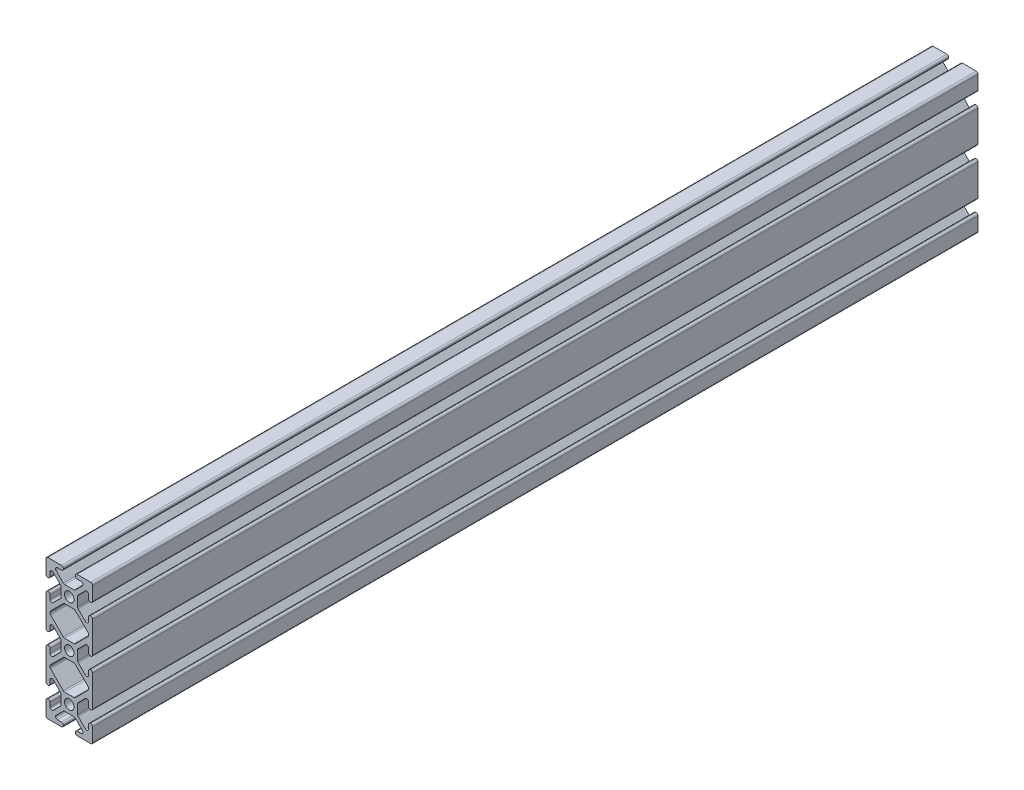
from build123d import *

# Parameters (mm, degrees)
SKETCH1_R            = 2.6035
MAIN_EXTRUSION_DEPTH = 241.3


with BuildPart() as part:
    # Sketch1 → Main Extrusion (new, symmetric)
    with BuildSketch(Plane.XY):
        with BuildLine():
            Line((-12.7, 37.084), (-12.7, 29.6672))
            ThreePointArc((-12.7, 29.6672), (-12.40242049, 28.94877951), (-11.684, 28.6512))
            Line((-11.684, 28.6512), (-11.5062, 28.6512))
            ThreePointArc((-11.5062, 28.6512), (-10.78777951, 28.94877951), (-10.4902, 29.6672))
            Line((-10.4902, 29.6672), (-10.4902, 31.874794456))
            ThreePointArc((-10.4902, 31.874794456), (-9.863006367, 32.813456061), (-8.75577951, 32.593214945))
            Line((-8.75577951, 32.593214945), (-4.81877951, 28.656214945))
            ThreePointArc((-4.81877951, 28.656214945), (-4.598538395, 28.326600823), (-4.5212, 27.937794456))
            Line((-4.5212, 27.937794456), (-4.5212, 22.862205544))
            ThreePointArc((-4.5212, 22.862205544), (-4.598538395, 22.473399177), (-4.81877951, 22.143785055))
            Line((-4.81877951, 22.143785055), (-8.75577951, 18.206785055))
            ThreePointArc((-8.75577951, 18.206785055), (-9.863006367, 17.986543939), (-10.4902, 18.925205544))
            Line((-10.4902, 18.925205544), (-10.4902, 21.1328))
            ThreePointArc((-10.4902, 21.1328), (-10.78777951, 21.85122049), (-11.5062, 22.1488))
            Line((-11.5062, 22.1488), (-11.684, 22.1488))
            ThreePointArc((-11.684, 22.1488), (-12.40242049, 21.85122049), (-12.7, 21.1328))
            Line((-12.7, 21.1328), (-12.7, 4.2672))
            ThreePointArc((-12.7, 4.2672), (-12.40242049, 3.54877951), (-11.684, 3.2512))
            Line((-11.684, 3.2512), (-11.5062, 3.2512))
            ThreePointArc((-11.5062, 3.2512), (-10.78777951, 3.54877951), (-10.4902, 4.2672))
            Line((-10.4902, 4.2672), (-10.4902, 6.474794456))
            ThreePointArc((-10.4902, 6.474794456), (-9.863006367, 7.413456061), (-8.75577951, 7.193214945))
            Line((-8.75577951, 7.193214945), (-4.81877951, 3.256214945))
            ThreePointArc((-4.81877951, 3.256214945), (-4.598538395, 2.926600823), (-4.5212, 2.537794456))
            Line((-4.5212, 2.537794456), (-4.5212, -2.537794456))
            ThreePointArc((-4.5212, -2.537794456), (-4.598538395, -2.926600823), (-4.81877951, -3.256214945))
            Line((-4.81877951, -3.256214945), (-8.75577951, -7.193214945))
            ThreePointArc((-8.75577951, -7.193214945), (-9.863006367, -7.413456061), (-10.4902, -6.474794456))
            Line((-10.4902, -6.474794456), (-10.4902, -4.2672))
            ThreePointArc((-10.4902, -4.2672), (-10.78777951, -3.54877951), (-11.5062, -3.2512))
            Line((-11.5062, -3.2512), (-11.684, -3.2512))
            ThreePointArc((-11.684, -3.2512), (-12.40242049, -3.54877951), (-12.7, -4.2672))
            Line((-12.7, -4.2672), (-12.7, -21.1328))
            ThreePointArc((-12.7, -21.1328), (-12.40242049, -21.85122049), (-11.684, -22.1488))
            Line((-11.684, -22.1488), (-11.5062, -22.1488))
            ThreePointArc((-11.5062, -22.1488), (-10.78777951, -21.85122049), (-10.4902, -21.1328))
            Line((-10.4902, -21.1328), (-10.4902, -18.925205544))
            ThreePointArc((-10.4902, -18.925205544), (-9.863006367, -17.986543939), (-8.75577951, -18.206785055))
            Line((-8.75577951, -18.206785055), (-4.81877951, -22.143785055))
            ThreePointArc((-4.81877951, -22.143785055), (-4.598538395, -22.473399177), (-4.5212, -22.862205544))
            Line((-4.5212, -22.862205544), (-4.5212, -27.937794456))
            ThreePointArc((-4.5212, -27.937794456), (-4.598538395, -28.326600823), (-4.81877951, -28.656214945))
            Line((-4.81877951, -28.656214945), (-8.75577951, -32.593214945))
            ThreePointArc((-8.75577951, -32.593214945), (-9.863006367, -32.813456061), (-10.4902, -31.874794456))
            Line((-10.4902, -31.874794456), (-10.4902, -29.6672))
            ThreePointArc((-10.4902, -29.6672), (-10.78777951, -28.94877951), (-11.5062, -28.6512))
            Line((-11.5062, -28.6512), (-11.684, -28.6512))
            ThreePointArc((-11.684, -28.6512), (-12.40242049, -28.94877951), (-12.7, -29.6672))
            Line((-12.7, -29.6672), (-12.7, -37.084))
            ThreePointArc((-12.7, -37.084), (-12.40242049, -37.80242049), (-11.684, -38.1))
            Line((-11.684, -38.1), (-4.2672, -38.1))
            ThreePointArc((-4.2672, -38.1), (-3.54877951, -37.80242049), (-3.2512, -37.084))
            Line((-3.2512, -37.084), (-3.2512, -36.9062))
            ThreePointArc((-3.2512, -36.9062), (-3.54877951, -36.18777951), (-4.2672, -35.8902))
            Line((-4.2672, -35.8902), (-6.474794456, -35.8902))
            ThreePointArc((-6.474794456, -35.8902), (-7.413456061, -35.263006367), (-7.193214945, -34.15577951))
            Line((-7.193214945, -34.15577951), (-3.256214945, -30.21877951))
            ThreePointArc((-3.256214945, -30.21877951), (-2.926600823, -29.998538395), (-2.537794456, -29.9212))
            Line((-2.537794456, -29.9212), (2.537794456, -29.9212))
            ThreePointArc((2.537794456, -29.9212), (2.926600823, -29.998538395), (3.256214945, -30.21877951))
            Line((3.256214945, -30.21877951), (7.193214945, -34.15577951))
            ThreePointArc((7.193214945, -34.15577951), (7.413456061, -35.263006367), (6.474794456, -35.8902))
            Line((6.474794456, -35.8902), (4.2672, -35.8902))
            ThreePointArc((4.2672, -35.8902), (3.54877951, -36.18777951), (3.2512, -36.9062))
            Line((3.2512, -36.9062), (3.2512, -37.084))
            ThreePointArc((3.2512, -37.084), (3.54877951, -37.80242049), (4.2672, -38.1))
            Line((4.2672, -38.1), (11.684, -38.1))
            ThreePointArc((11.684, -38.1), (12.40242049, -37.80242049), (12.7, -37.084))
            Line((12.7, -37.084), (12.7, -29.6672))
            ThreePointArc((12.7, -29.6672), (12.40242049, -28.94877951), (11.684, -28.6512))
            Line((11.684, -28.6512), (11.5062, -28.6512))
            ThreePointArc((11.5062, -28.6512), (10.78777951, -28.94877951), (10.4902, -29.6672))
            Line((10.4902, -29.6672), (10.4902, -31.874794456))
            ThreePointArc((10.4902, -31.874794456), (9.863006367, -32.813456061), (8.75577951, -32.593214945))
            Line((8.75577951, -32.593214945), (4.81877951, -28.656214945))
            ThreePointArc((4.81877951, -28.656214945), (4.598538395, -28.326600823), (4.5212, -27.937794456))
            Line((4.5212, -27.937794456), (4.5212, -22.862205544))
            ThreePointArc((4.5212, -22.862205544), (4.598538395, -22.473399177), (4.81877951, -22.143785055))
            Line((4.81877951, -22.143785055), (8.75577951, -18.206785055))
            ThreePointArc((8.75577951, -18.206785055), (9.863006367, -17.986543939), (10.4902, -18.925205544))
            Line((10.4902, -18.925205544), (10.4902, -21.1328))
            ThreePointArc((10.4902, -21.1328), (10.78777951, -21.85122049), (11.5062, -22.1488))
            Line((11.5062, -22.1488), (11.684, -22.1488))
            ThreePointArc((11.684, -22.1488), (12.40242049, -21.85122049), (12.7, -21.1328))
            Line((12.7, -21.1328), (12.7, -4.2672))
            ThreePointArc((12.7, -4.2672), (12.40242049, -3.54877951), (11.684, -3.2512))
            Line((11.684, -3.2512), (11.5062, -3.2512))
            ThreePointArc((11.5062, -3.2512), (10.78777951, -3.54877951), (10.4902, -4.2672))
            Line((10.4902, -4.2672), (10.4902, -6.474794456))
            ThreePointArc((10.4902, -6.474794456), (9.863006367, -7.413456061), (8.75577951, -7.193214945))
            Line((8.75577951, -7.193214945), (4.81877951, -3.256214945))
            ThreePointArc((4.81877951, -3.256214945), (4.598538395, -2.926600823), (4.5212, -2.537794456))
            Line((4.5212, -2.537794456), (4.5212, 2.537794456))
            ThreePointArc((4.5212, 2.537794456), (4.598538395, 2.926600823), (4.81877951, 3.256214945))
            Line((4.81877951, 3.256214945), (8.75577951, 7.193214945))
            ThreePointArc((8.75577951, 7.193214945), (9.863006367, 7.413456061), (10.4902, 6.474794456))
            Line((10.4902, 6.474794456), (10.4902, 4.2672))
            ThreePointArc((10.4902, 4.2672), (10.78777951, 3.54877951), (11.5062, 3.2512))
            Line((11.5062, 3.2512), (11.684, 3.2512))
            ThreePointArc((11.684, 3.2512), (12.40242049, 3.54877951), (12.7, 4.2672))
            Line((12.7, 4.2672), (12.7, 21.1328))
            ThreePointArc((12.7, 21.1328), (12.40242049, 21.85122049), (11.684, 22.1488))
            Line((11.684, 22.1488), (11.5062, 22.1488))
            ThreePointArc((11.5062, 22.1488), (10.78777951, 21.85122049), (10.4902, 21.1328))
            Line((10.4902, 21.1328), (10.4902, 18.925205544))
            ThreePointArc((10.4902, 18.925205544), (9.863006367, 17.986543939), (8.75577951, 18.206785055))
            Line((8.75577951, 18.206785055), (4.81877951, 22.143785055))
            ThreePointArc((4.81877951, 22.143785055), (4.598538395, 22.473399177), (4.5212, 22.862205544))
            Line((4.5212, 22.862205544), (4.5212, 27.937794456))
            ThreePointArc((4.5212, 27.937794456), (4.598538395, 28.326600823), (4.81877951, 28.656214945))
            Line((4.81877951, 28.656214945), (8.75577951, 32.593214945))
            ThreePointArc((8.75577951, 32.593214945), (9.863006367, 32.813456061), (10.4902, 31.874794456))
            Line((10.4902, 31.874794456), (10.4902, 29.6672))
            ThreePointArc((10.4902, 29.6672), (10.78777951, 28.94877951), (11.5062, 28.6512))
            Line((11.5062, 28.6512), (11.684, 28.6512))
            ThreePointArc((11.684, 28.6512), (12.40242049, 28.94877951), (12.7, 29.6672))
            Line((12.7, 29.6672), (12.7, 37.084))
            ThreePointArc((12.7, 37.084), (12.40242049, 37.80242049), (11.684, 38.1))
            Line((11.684, 38.1), (4.2672, 38.1))
            ThreePointArc((4.2672, 38.1), (3.54877951, 37.80242049), (3.2512, 37.084))
            Line((3.2512, 37.084), (3.2512, 36.9062))
            ThreePointArc((3.2512, 36.9062), (3.54877951, 36.18777951), (4.2672, 35.8902))
            Line((4.2672, 35.8902), (6.474794456, 35.8902))
            ThreePointArc((6.474794456, 35.8902), (7.413456061, 35.263006367), (7.193214945, 34.15577951))
            Line((7.193214945, 34.15577951), (3.256214945, 30.21877951))
            ThreePointArc((3.256214945, 30.21877951), (2.926600823, 29.998538395), (2.537794456, 29.9212))
            Line((2.537794456, 29.9212), (-2.537794456, 29.9212))
            ThreePointArc((-2.537794456, 29.9212), (-2.926600823, 29.998538395), (-3.256214945, 30.21877951))
            Line((-3.256214945, 30.21877951), (-7.193214945, 34.15577951))
            ThreePointArc((-7.193214945, 34.15577951), (-7.413456061, 35.263006367), (-6.474794456, 35.8902))
            Line((-6.474794456, 35.8902), (-4.2672, 35.8902))
            ThreePointArc((-4.2672, 35.8902), (-3.54877951, 36.18777951), (-3.2512, 36.9062))
            Line((-3.2512, 36.9062), (-3.2512, 37.084))
            ThreePointArc((-3.2512, 37.084), (-3.54877951, 37.80242049), (-4.2672, 38.1))
            Line((-4.2672, 38.1), (-11.684, 38.1))
            ThreePointArc((-11.684, 38.1), (-12.40242049, 37.80242049), (-12.7, 37.084))
        make_face()
        with Locations(Location((0, 25.4, 0), (0, 0, 180))):
            Circle(SKETCH1_R, mode=Mode.SUBTRACT)
        with Locations(Location((0, 0, 0), (0, 0, 180))):
            Circle(SKETCH1_R, mode=Mode.SUBTRACT)
        with Locations(Location((0, -25.4, 0), (0, 0, 180))):
            Circle(SKETCH1_R, mode=Mode.SUBTRACT)
        with BuildLine():
            Line((-10.4902, 12.473605544), (-10.4902, 12.926394456))
            ThreePointArc((-10.4902, 12.926394456), (-10.412861605, 13.315200823), (-10.19262049, 13.644814945))
            Line((-10.19262049, 13.644814945), (-3.256214945, 20.58122049))
            ThreePointArc((-3.256214945, 20.58122049), (-2.926600823, 20.801461605), (-2.537794456, 20.8788))
            Line((-2.537794456, 20.8788), (2.537794456, 20.8788))
            ThreePointArc((2.537794456, 20.8788), (2.926600823, 20.801461605), (3.256214945, 20.58122049))
            Line((3.256214945, 20.58122049), (10.19262049, 13.644814945))
            ThreePointArc((10.19262049, 13.644814945), (10.412861605, 13.315200823), (10.4902, 12.926394456))
            Line((10.4902, 12.926394456), (10.4902, 12.473605544))
            ThreePointArc((10.4902, 12.473605544), (10.412861605, 12.084799177), (10.19262049, 11.755185055))
            Line((10.19262049, 11.755185055), (3.256214945, 4.81877951))
            ThreePointArc((3.256214945, 4.81877951), (2.926600823, 4.598538395), (2.537794456, 4.5212))
            Line((2.537794456, 4.5212), (-2.537794456, 4.5212))
            ThreePointArc((-2.537794456, 4.5212), (-2.926600823, 4.598538395), (-3.256214945, 4.81877951))
            Line((-3.256214945, 4.81877951), (-10.19262049, 11.755185055))
            ThreePointArc((-10.19262049, 11.755185055), (-10.412861605, 12.084799177), (-10.4902, 12.473605544))
        make_face(mode=Mode.SUBTRACT)
        with BuildLine():
            Line((-2.537794456, -4.5212), (2.537794456, -4.5212))
            ThreePointArc((2.537794456, -4.5212), (2.926600823, -4.598538395), (3.256214945, -4.81877951))
            Line((3.256214945, -4.81877951), (10.19262049, -11.755185055))
            ThreePointArc((10.19262049, -11.755185055), (10.412861605, -12.084799177), (10.4902, -12.473605544))
            Line((10.4902, -12.473605544), (10.4902, -12.926394456))
            ThreePointArc((10.4902, -12.926394456), (10.412861605, -13.315200823), (10.19262049, -13.644814945))
            Line((10.19262049, -13.644814945), (3.256214945, -20.58122049))
            ThreePointArc((3.256214945, -20.58122049), (2.926600823, -20.801461605), (2.537794456, -20.8788))
            Line((2.537794456, -20.8788), (-2.537794456, -20.8788))
            ThreePointArc((-2.537794456, -20.8788), (-2.926600823, -20.801461605), (-3.256214945, -20.58122049))
            Line((-3.256214945, -20.58122049), (-10.19262049, -13.644814945))
            ThreePointArc((-10.19262049, -13.644814945), (-10.412861605, -13.315200823), (-10.4902, -12.926394456))
            Line((-10.4902, -12.926394456), (-10.4902, -12.473605544))
            ThreePointArc((-10.4902, -12.473605544), (-10.412861605, -12.084799177), (-10.19262049, -11.755185055))
            Line((-10.19262049, -11.755185055), (-3.256214945, -4.81877951))
            ThreePointArc((-3.256214945, -4.81877951), (-2.926600823, -4.598538395), (-2.537794456, -4.5212))
        make_face(mode=Mode.SUBTRACT)
    extrude(amount=MAIN_EXTRUSION_DEPTH, both=True)


solid = part.part
